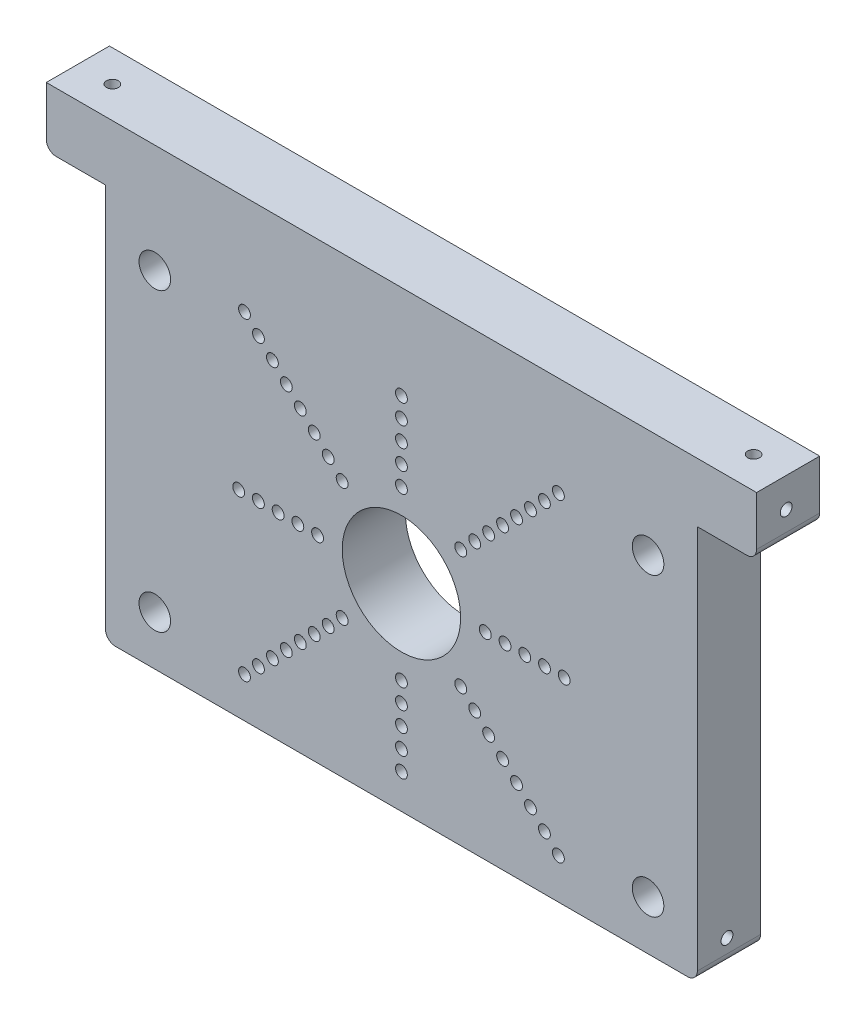
from build123d import *

# Parameters (mm, degrees)
SKETCH1_W           = 300
SKETCH1_H           = 200
SKETCH1_R           = 8
BOSS_EXTRUDE1_DEPTH = 32
SKETCH2_R           = 3
CUT_EXTRUDE2_DEPTH  = 32
CUT_EXTRUDE4_DEPTH  = 16
FILLET4_R           = 10
FILLET8_R           = 10
BOSS_EXTRUDE2_DEPTH = 32
SKETCH6_R           = 30
CUT_EXTRUDE5_DEPTH  = 32
FILLET9_R           = 5
CUT_EXTRUDE6_DEPTH  = 10
CUT_EXTRUDE7_START  = -10
CUT_EXTRUDE7_DEPTH  = 10
SKETCH9_R           = 3
CUT_EXTRUDE8_DEPTH  = 10
CUT_EXTRUDE9_START  = -10
SKETCH10_R          = 3
CUT_EXTRUDE9_DEPTH  = 10
SKETCH11_R          = 3
CUT_EXTRUDE11_DEPTH = 153
SKETCH12_R          = 3
CUT_EXTRUDE12_DEPTH = 5


with BuildPart() as part:
    # Sketch1 → Boss-Extrude1 (new body)
    with BuildSketch(Plane.XY):
        Rectangle(SKETCH1_W, SKETCH1_H)
        with Locations((125, 75)):
            Circle(SKETCH1_R, mode=Mode.SUBTRACT)
        with Locations((125, -75)):
            Circle(SKETCH1_R, mode=Mode.SUBTRACT)
        with Locations((-125, -75)):
            Circle(SKETCH1_R, mode=Mode.SUBTRACT)
        with Locations((-125, 75)):
            Circle(SKETCH1_R, mode=Mode.SUBTRACT)
    extrude(amount=BOSS_EXTRUDE1_DEPTH)

    # Sketch2 → Cut-Extrude2 (cut)
    with BuildSketch(Plane.XY.offset(32)):
        with Locations((58.336309448, -58.336309448)):
            Circle(SKETCH2_R)
        with Locations((51.265241636, -51.265241636)):
            Circle(SKETCH2_R)
        with Locations((44.194173824, -44.194173824)):
            Circle(SKETCH2_R)
        with Locations((37.123106012, -37.123106012)):
            Circle(SKETCH2_R)
        with Locations((30.0520382, -30.0520382)):
            Circle(SKETCH2_R)
        with Locations((65.40737726, -65.40737726)):
            Circle(SKETCH2_R)
        with Locations((72.478445072, -72.478445072)):
            Circle(SKETCH2_R)
        with Locations((42.5, 0)):
            Circle(SKETCH2_R)
        with Locations((52.5, 0)):
            Circle(SKETCH2_R)
        with Locations((62.5, 0)):
            Circle(SKETCH2_R)
        with Locations((72.5, 0)):
            Circle(SKETCH2_R)
        with Locations((82.5, 0)):
            Circle(SKETCH2_R)
        with Locations((79.549512883, -79.549512883)):
            Circle(SKETCH2_R)
        with Locations((0, -82.5)):
            Circle(SKETCH2_R)
        with Locations((0, -72.5)):
            Circle(SKETCH2_R)
        with Locations((0, -62.5)):
            Circle(SKETCH2_R)
        with Locations((0, -52.5)):
            Circle(SKETCH2_R)
        with Locations((0, -42.5)):
            Circle(SKETCH2_R)
        with Locations((-65.40737726, -65.40737726)):
            Circle(SKETCH2_R)
        with Locations((-72.478445072, -72.478445072)):
            Circle(SKETCH2_R)
        with Locations((-58.336309448, -58.336309448)):
            Circle(SKETCH2_R)
        with Locations((-51.265241636, -51.265241636)):
            Circle(SKETCH2_R)
        with Locations((-44.194173824, -44.194173824)):
            Circle(SKETCH2_R)
        with Locations((-37.123106012, -37.123106012)):
            Circle(SKETCH2_R)
        with Locations((-30.0520382, -30.0520382)):
            Circle(SKETCH2_R)
        with Locations((-79.549512883, -79.549512883)):
            Circle(SKETCH2_R)
        with Locations((-82.5, 0)):
            Circle(SKETCH2_R)
        with Locations((-72.5, 0)):
            Circle(SKETCH2_R)
        with Locations((-62.5, 0)):
            Circle(SKETCH2_R)
        with Locations((-52.5, 0)):
            Circle(SKETCH2_R)
        with Locations((-42.5, 0)):
            Circle(SKETCH2_R)
        with Locations((-65.40737726, 65.40737726)):
            Circle(SKETCH2_R)
        with Locations((-72.478445072, 72.478445072)):
            Circle(SKETCH2_R)
        with Locations((-58.336309448, 58.336309448)):
            Circle(SKETCH2_R)
        with Locations((-51.265241636, 51.265241636)):
            Circle(SKETCH2_R)
        with Locations((-44.194173824, 44.194173824)):
            Circle(SKETCH2_R)
        with Locations((-37.123106012, 37.123106012)):
            Circle(SKETCH2_R)
        with Locations((-30.0520382, 30.0520382)):
            Circle(SKETCH2_R)
        with Locations((-79.549512883, 79.549512883)):
            Circle(SKETCH2_R)
        with Locations((0, 82.5)):
            Circle(SKETCH2_R)
        with Locations((0, 72.5)):
            Circle(SKETCH2_R)
        with Locations((0, 62.5)):
            Circle(SKETCH2_R)
        with Locations((0, 52.5)):
            Circle(SKETCH2_R)
        with Locations((0, 42.5)):
            Circle(SKETCH2_R)
        with Locations((65.40737726, 65.40737726)):
            Circle(SKETCH2_R)
        with Locations((72.478445072, 72.478445072)):
            Circle(SKETCH2_R)
        with Locations((58.336309448, 58.336309448)):
            Circle(SKETCH2_R)
        with Locations((51.265241636, 51.265241636)):
            Circle(SKETCH2_R)
        with Locations((44.194173824, 44.194173824)):
            Circle(SKETCH2_R)
        with Locations((37.123106012, 37.123106012)):
            Circle(SKETCH2_R)
        with Locations((30.0520382, 30.0520382)):
            Circle(SKETCH2_R)
        with Locations((79.549512883, 79.549512883)):
            Circle(SKETCH2_R)
    extrude(amount=-CUT_EXTRUDE2_DEPTH, mode=Mode.SUBTRACT)

    # Sketch4 → Cut-Extrude4 (cut)
    with BuildSketch(Plane(origin=(0, 0, 0), x_dir=(-1, 0, 0), z_dir=(0, 0, -1))):
        with BuildLine():
            ThreePointArc((-91.942153666, 81.335551948), (-125.113286784, 50.428772354), (-139.696619787, 7.5))
            Line((-139.696619787, 7.5), (-18.106601718, 7.5))
            Line((-18.106601718, 7.5), (-91.942153666, 81.335551948))
        make_face()
        with BuildLine():
            ThreePointArc((-7.5, 83.969594837), (-41.99087281, 92.714109158), (-77.238242942, 87.844844659))
            Line((-77.238242942, 87.844844659), (-7.5, 18.106601718))
            Line((-7.5, 18.106601718), (-7.5, 83.969594837))
        make_face()
        with BuildLine():
            Line((7.5, 18.106601718), (77.238242942, 87.844844659))
            ThreePointArc((77.238242942, 87.844844659), (41.99087281, 92.714109158), (7.5, 83.969594837))
            Line((7.5, 83.969594837), (7.5, 18.106601718))
        make_face()
        with BuildLine():
            Line((18.106601718, 7.5), (139.696619787, 7.5))
            ThreePointArc((139.696619787, 7.5), (125.113286784, 50.428772354), (91.942153666, 81.335551948))
            Line((91.942153666, 81.335551948), (18.106601718, 7.5))
        make_face()
        with BuildLine():
            Line((18.106601718, -7.5), (91.942153666, -81.335551948))
            ThreePointArc((91.942153666, -81.335551948), (125.113286784, -50.428772354), (139.696619787, -7.5))
            Line((139.696619787, -7.5), (18.106601718, -7.5))
        make_face()
        with BuildLine():
            Line((7.5, -18.106601718), (7.5, -83.969594837))
            ThreePointArc((7.5, -83.969594837), (41.99087281, -92.714109158), (77.238242942, -87.844844659))
            Line((77.238242942, -87.844844659), (7.5, -18.106601718))
        make_face()
        with BuildLine():
            Line((-7.5, -83.969594837), (-7.5, -18.106601718))
            Line((-7.5, -18.106601718), (-77.238242942, -87.844844659))
            ThreePointArc((-77.238242942, -87.844844659), (-41.99087281, -92.714109158), (-7.5, -83.969594837))
        make_face()
        with BuildLine():
            ThreePointArc((-139.696619787, -7.5), (-125.113286784, -50.428772354), (-91.942153666, -81.335551948))
            Line((-91.942153666, -81.335551948), (-18.106601718, -7.5))
            Line((-18.106601718, -7.5), (-139.696619787, -7.5))
        make_face()
    extrude(amount=-CUT_EXTRUDE4_DEPTH, mode=Mode.SUBTRACT)

    # Fillet4
    fillet4_edges = [part.edges().sort_by_distance(p)[0] for p in [
        (18.106601718, 7.5, 8),
        (7.5, 18.106601718, 8),
        (-18.106601718, 7.5, 8),
        (-7.5, 18.106601718, 8),
        (-7.5, -18.106601718, 8),
        (-18.106601718, -7.5, 8),
        (18.106601718, -7.5, 8),
        (7.5, -18.106601718, 8),
    ]]
    fillet(fillet4_edges, radius=FILLET4_R)

    # Fillet8
    fillet8_edges = [part.edges().sort_by_distance(p)[0] for p in [
        (91.942153666, 81.335551948, 8),
        (139.696619787, 7.5, 8),
        (7.5, 83.969594837, 8),
        (77.238242942, 87.844844659, 8),
        (-91.942153666, 81.335551948, 8),
        (-139.696619787, 7.5, 8),
        (-7.5, 83.969594837, 8),
        (-77.238242942, 87.844844659, 8),
        (-77.238242942, -87.844844659, 8),
        (-7.5, -83.969594837, 8),
        (-139.696619787, -7.5, 8),
        (-91.942153666, -81.335551948, 8),
        (139.696619787, -7.5, 8),
        (91.942153666, -81.335551948, 8),
        (77.238242942, -87.844844659, 8),
        (7.5, -83.969594837, 8),
    ]]
    fillet(fillet8_edges, radius=FILLET8_R)

    # Sketch5 → Boss-Extrude2 (add)
    with BuildSketch(Plane(origin=(0, 0, 0), x_dir=(-1, 0, 0), z_dir=(0, 0, -1))):
        Polygon((-150, 100), (-180, 100), (-180, 130), (180, 130), (180, 100), (150, 100), align=None)
    extrude(amount=-BOSS_EXTRUDE2_DEPTH)

    # Sketch6 → Cut-Extrude5 (cut)
    with BuildSketch(Plane(origin=(0, 0, 0), x_dir=(-1, 0, 0), z_dir=(0, 0, -1))):
        Circle(SKETCH6_R)
    extrude(amount=-CUT_EXTRUDE5_DEPTH, mode=Mode.SUBTRACT)

    # Fillet9
    fillet9_edges = [part.edges().sort_by_distance(p)[0] for p in [
        (-180, 100, 16),
        (180, 100, 16),
        (150, -100, 16),
        (-150, -100, 16),
    ]]
    fillet(fillet9_edges, radius=FILLET9_R)

    # Sketch7 → Cut-Extrude6 (cut)
    with BuildSketch(Plane.ZY.offset(180)):
        with BuildLine():
            ThreePointArc((20, 115), (19.121320344, 117.121320344), (17, 118))
            Line((17, 118), (17, 115))
            Line((17, 115), (20, 115))
        make_face()
        with BuildLine():
            Line((17, 115), (17, 118))
            ThreePointArc((17, 118), (14.878679656, 112.878679656), (20, 115))
            Line((20, 115), (17, 115))
        make_face()
    extrude(amount=-CUT_EXTRUDE6_DEPTH, mode=Mode.SUBTRACT)

    # Sketch8 → Cut-Extrude7 (cut)
    with BuildSketch(Plane(origin=(180, 0, 0), x_dir=(0, 0, -1), z_dir=(1, 0, 0)).offset(CUT_EXTRUDE7_START)):
        with BuildLine():
            ThreePointArc((-14, 115), (-14.878679656, 117.121320344), (-17, 118))
            Line((-17, 118), (-17, 115))
            Line((-17, 115), (-20, 115))
            ThreePointArc((-20, 115), (-17, 112), (-14, 115))
        make_face()
        with BuildLine():
            Line((-17, 115), (-17, 118))
            ThreePointArc((-17, 118), (-19.121320344, 117.121320344), (-20, 115))
            Line((-20, 115), (-17, 115))
        make_face()
    extrude(amount=CUT_EXTRUDE7_DEPTH, mode=Mode.SUBTRACT)

    # Sketch9 → Cut-Extrude8 (cut)
    with BuildSketch(Plane(origin=(150, 0, 0), x_dir=(0, 0, -1), z_dir=(1, 0, 0))):
        with Locations(Location((-17, -88, 0), (0, 0, 90))):
            Circle(SKETCH9_R)
    extrude(amount=-CUT_EXTRUDE8_DEPTH, mode=Mode.SUBTRACT)

    # Sketch10 → Cut-Extrude9 (cut)
    with BuildSketch(Plane.ZY.offset(150).offset(CUT_EXTRUDE9_START)):
        with Locations(Location((17, -88, 0), (0, 0, 90))):
            Circle(SKETCH10_R)
    extrude(amount=CUT_EXTRUDE9_DEPTH, mode=Mode.SUBTRACT)

    # Sketch11 → Cut-Extrude11 (cut)
    with BuildSketch(Plane(origin=(0, 100, 0), x_dir=(-1, 0, 0), z_dir=(0, -1, 0))):
        with BuildLine():
            ThreePointArc((164.346932126, -13.635926879), (160.135926879, -14.153067874), (160.653067874, -18.364073121))
            Line((160.653067874, -18.364073121), (164.346932126, -13.635926879))
        make_face()
        with BuildLine():
            Line((164.346932126, -13.635926879), (160.653067874, -18.364073121))
            ThreePointArc((160.653067874, -18.364073121), (163.815143266, -18.696367592), (165.5, -16))
            ThreePointArc((165.5, -16), (165.196367592, -14.684856734), (164.346932126, -13.635926879))
        make_face()
        with Locations(Location((-162.5, -16, 0), (0, 0, 90))):
            Circle(SKETCH11_R)
    extrude(amount=-CUT_EXTRUDE11_DEPTH, mode=Mode.SUBTRACT)

    # Sketch12 → Cut-Extrude12 (cut)
    with BuildSketch(Plane(origin=(0, -100, 0), x_dir=(-1, 0, 0), z_dir=(0, -1, 0))):
        with Locations(Location((138, -17, 0), (0, 0, 180))):
            Circle(SKETCH12_R)
        with Locations(Location((-138, -17, 0), (0, 0, 180))):
            Circle(SKETCH12_R)
    extrude(amount=-CUT_EXTRUDE12_DEPTH, mode=Mode.SUBTRACT)


solid = part.part
